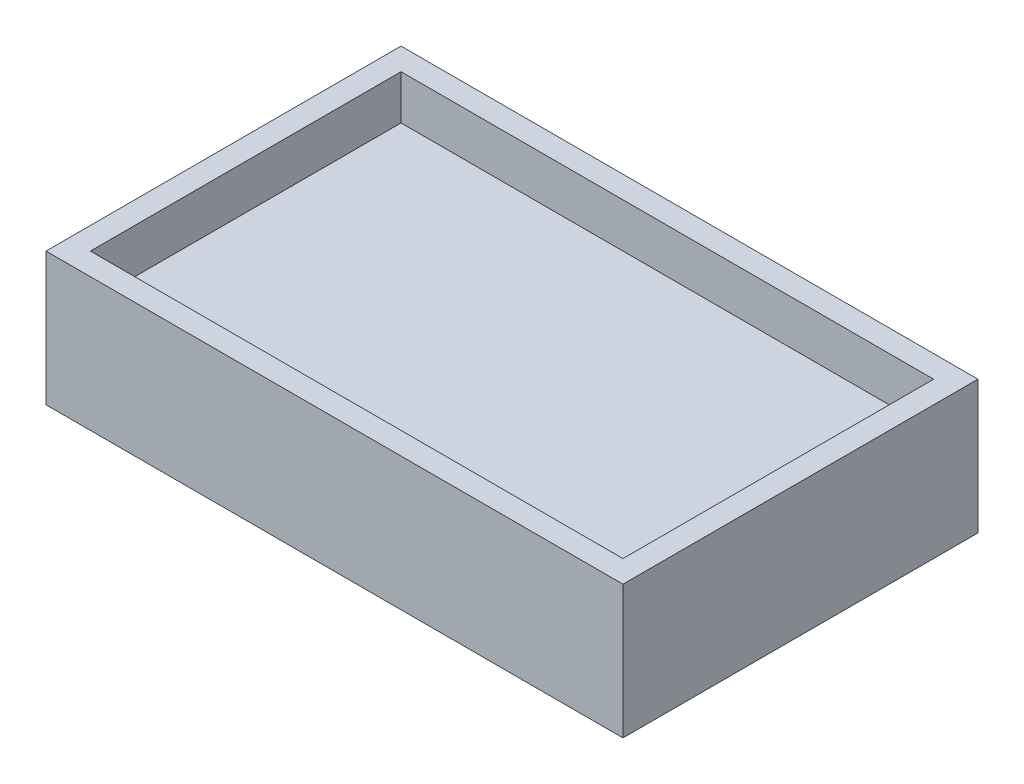
from build123d import *

# Parameters (mm, degrees)
SKETCH2_W           = 130
SKETCH2_H           = 80
BOSS_EXTRUDE1_DEPTH = 25
SKETCH5_W           = 120
SKETCH5_H           = 70
CUT_EXTRUDE1_DEPTH  = 10
SKETCH6_W           = 130
SKETCH6_H           = 80
BOSS_EXTRUDE2_DEPTH = 5


with BuildPart() as part:
    # Sketch2 → Boss-Extrude1 (new body)
    with BuildSketch(Plane(origin=(0, 0, 0), x_dir=(1, 0, 0), z_dir=(0, 1, 0))):
        Rectangle(SKETCH2_W, SKETCH2_H)
    extrude(amount=BOSS_EXTRUDE1_DEPTH)

    # Sketch5 → Cut-Extrude1 (cut)
    with BuildSketch(Plane(origin=(0, 25, 0), x_dir=(1, 0, 0), z_dir=(0, 1, 0))):
        Rectangle(SKETCH5_W, SKETCH5_H)
    extrude(amount=-CUT_EXTRUDE1_DEPTH, mode=Mode.SUBTRACT)

    # Sketch6 → Boss-Extrude2 (add)
    with BuildSketch(Plane(origin=(0, 0, 0), x_dir=(-1, 0, 0), z_dir=(0, -1, 0))):
        Rectangle(SKETCH6_W, SKETCH6_H)
    extrude(amount=BOSS_EXTRUDE2_DEPTH)


solid = part.part
